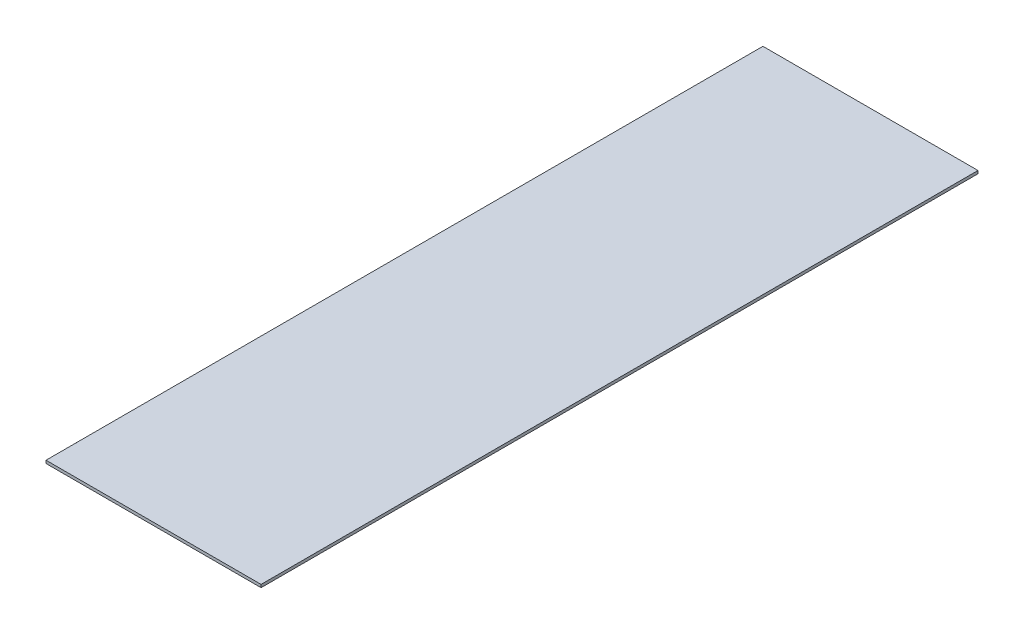
from build123d import *

# Parameters (mm, degrees)
SKETCH_1_W      = 300
SKETCH_1_H      = 1000
EXTRUDE_1_DEPTH = 4


with BuildPart() as part:
    # 草图1 → 凸台-拉伸1 (new body)
    with BuildSketch(Plane(origin=(0, 0, 0), x_dir=(1, 0, 0), z_dir=(0, 1, 0))):
        Rectangle(SKETCH_1_W, SKETCH_1_H)
    extrude(amount=EXTRUDE_1_DEPTH)


solid = part.part
